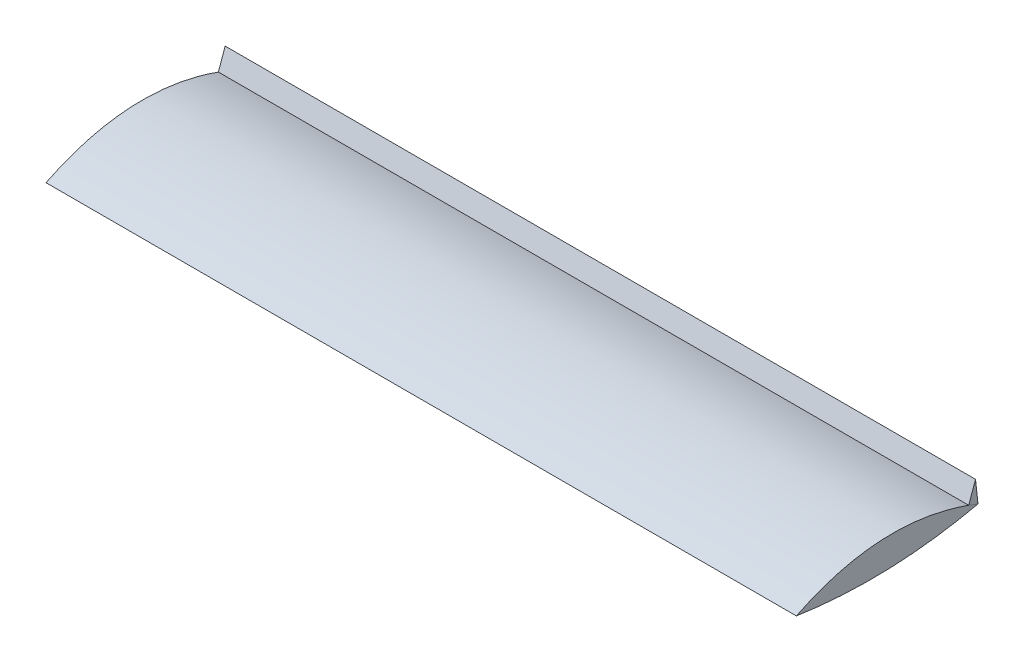
from build123d import *

# Parameters (mm, degrees)
BOSS_EXTRUDE1_DEPTH   = 1016
BOSS_EXTRUDE1_2_DEPTH = 1016


with BuildPart() as part:
    # Sketch2 → Boss-Extrude1 (new body)
    with BuildSketch(Plane(origin=(0, 0, 0), x_dir=(0, 0, -1), z_dir=(1, 0, 0))):
        with BuildLine():
            add(Edge.make_bspline(
                [(120.209701767, -8.006825936), (126.478710255, -10.244414316), (132.76663858, -12.751006433)],
                knots=[0.950418901, 0.950418901, 0.950418901, 1, 1, 1], degree=2))
            Line((132.76663858, -12.751006433), (129.433673407, 17.835798665))
            Line((129.433673407, 17.835798665), (120.209701767, -8.006825936))
        make_face()
    extrude(amount=BOSS_EXTRUDE1_DEPTH)


with BuildPart() as body_2:
    # Sketch2 → Boss-Extrude1 2 (new body)
    with BuildSketch(Plane(origin=(0, 0, 0), x_dir=(0, 0, -1), z_dir=(1, 0, 0))):
        with BuildLine():
            add(Edge.make_bspline(
                [(132.76663858, -12.751006433), (11.292482382, -39.970187097), (-113.17915749, -21.067596797)],
                knots=[0, 0, 0, 1, 1, 1], degree=2))
            Line((132.76663858, -12.751006433), (120.209701767, -8.006825936))
            add(Edge.make_bspline(
                [(-113.17915749, -21.067596797), (0.039228649, 34.885451964), (120.209701767, -8.006825936)],
                knots=[0, 0, 0, 0.950418901, 0.950418901, 0.950418901], degree=2))
        make_face()
    extrude(amount=BOSS_EXTRUDE1_2_DEPTH)


solid = Compound([part.part, body_2.part])
